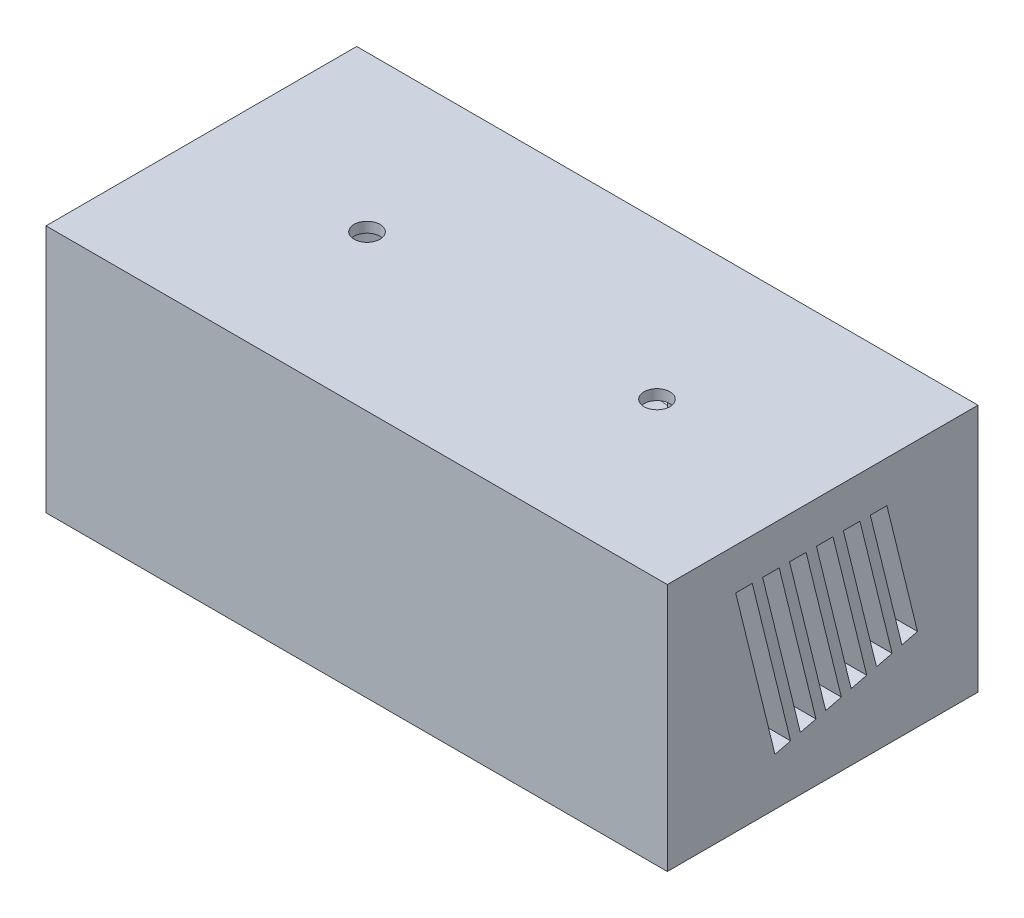
from build123d import *

# Parameters (mm, degrees)
SKETCH2_W                                     = 300
SKETCH2_H                                     = 150
BOSS_EXTRUDE1_DEPTH                           = 120
CUT_EXTRUDE2_DEPTH                            = 5
CUT_EXTRUDE3_DEPTH                            = 110
CBORE_FOR_M4_PAN_HEAD_MACHINE_SCREW1_AT_COUNT = 2
CBORE_FOR_M4_PAN_HEAD_MACHINE_SCREW1_AT_PITCH = 256
CBORE_FOR_M4_PAN_HEAD_MACHINE_SCREW1_2_COUNT  = 2
CBORE_FOR_M4_PAN_HEAD_MACHINE_SCREW1_2_PITCH  = 277.077606457
CBORE_FOR_M4_PAN_HEAD_MACHINE_SCREW1_3_COUNT  = 2
CBORE_FOR_M4_PAN_HEAD_MACHINE_SCREW1_3_PITCH  = 106
CUT_EXTRUDE5_DEPTH                            = 332.700165812
SKETCH17_R                                    = 15
CUT_EXTRUDE6_DEPTH                            = 20
SKETCH3_R                                     = 6.25
CUT_EXTRUDE1_DEPTH                            = 50


with BuildPart() as part:
    # Sketch2 → Boss-Extrude1 (new body)
    with BuildSketch(Plane(origin=(0, 0, 0), x_dir=(1, 0, 0), z_dir=(0, 1, 0))):
        Rectangle(SKETCH2_W, SKETCH2_H)
    extrude(amount=BOSS_EXTRUDE1_DEPTH)

    # Sketch7 → Cut-Extrude2 (cut)
    with BuildSketch(Plane.XZ):
        with BuildLine():
            Line((-120, 65), (120, 65))
            ThreePointArc((120, 65), (134.142135624, 59.142135624), (140, 45))
            Line((140, 45), (140, -45))
            ThreePointArc((140, -45), (134.142135624, -59.142135624), (120, -65))
            Line((120, -65), (-120, -65))
            ThreePointArc((-120, -65), (-134.142135624, -59.142135624), (-140, -45))
            Line((-140, -45), (-140, 45))
            ThreePointArc((-140, 45), (-134.142135624, 59.142135624), (-120, 65))
        make_face()
    extrude(amount=-CUT_EXTRUDE2_DEPTH, mode=Mode.SUBTRACT)

    # Sketch8 → Cut-Extrude3 (cut)
    with BuildSketch(Plane.XZ.offset(-5)):
        with BuildLine():
            Line((-91.715728753, 60), (91.715728753, 60))
            ThreePointArc((91.715728753, 60), (122.32233047, 47.32233047), (135, 16.715728753))
            Line((135, 16.715728753), (135, -16.715728753))
            ThreePointArc((135, -16.715728753), (122.32233047, -47.32233047), (91.715728753, -60))
            Line((91.715728753, -60), (-91.715728753, -60))
            ThreePointArc((-91.715728753, -60), (-122.32233047, -47.32233047), (-135, -16.715728753))
            Line((-135, -16.715728753), (-135, 16.715728753))
            ThreePointArc((-135, 16.715728753), (-122.32233047, 47.32233047), (-91.715728753, 60))
        make_face()
    extrude(amount=-CUT_EXTRUDE3_DEPTH, mode=Mode.SUBTRACT)

    # Sketch14 → CBORE for M4 Pan Head Machine Screw1 (revolve, cut)
    with BuildSketch(Plane(origin=(128, 0, -53), x_dir=(0, 0, -1), z_dir=(1, 0, 0))):
        Polygon((0, 0), (0, 31.351936393), (2.25, 30), (2.25, 3.1), (4.5, 3.1), (4.5, 0.025), (4.525, 0), align=None)
    cbore_for_m4_pan_head_machine_screw1 = revolve(axis=Axis((128, -6.35, -53), (0, 1, 0)), mode=Mode.SUBTRACT)

    # CBORE for M4 Pan Head Machine Screw1 at: CBORE for M4 Pan Head Machine Screw1 ×2
    with Locations(*[(-i * CBORE_FOR_M4_PAN_HEAD_MACHINE_SCREW1_AT_PITCH, 0, 0) for i in range(1, CBORE_FOR_M4_PAN_HEAD_MACHINE_SCREW1_AT_COUNT)]):
        add(cbore_for_m4_pan_head_machine_screw1, mode=Mode.SUBTRACT)

    # CBORE for M4 Pan Head Machine Screw1 2: CBORE for M4 Pan Head Machine Screw1 ×2
    with Locations(*[Vector(-0.9239288705910962, 0, 0.38256429797912606) * (i * CBORE_FOR_M4_PAN_HEAD_MACHINE_SCREW1_2_PITCH) for i in range(1, CBORE_FOR_M4_PAN_HEAD_MACHINE_SCREW1_2_COUNT)]):
        add(cbore_for_m4_pan_head_machine_screw1, mode=Mode.SUBTRACT)

    # CBORE for M4 Pan Head Machine Screw1 3: CBORE for M4 Pan Head Machine Screw1 ×2
    with Locations(*[(0, 0, i * CBORE_FOR_M4_PAN_HEAD_MACHINE_SCREW1_3_PITCH) for i in range(1, CBORE_FOR_M4_PAN_HEAD_MACHINE_SCREW1_3_COUNT)]):
        add(cbore_for_m4_pan_head_machine_screw1, mode=Mode.SUBTRACT)

    # Sketch15 → Cut-Extrude5 (cut, through all)
    with BuildSketch(Plane(origin=(150, 0, 0), x_dir=(0, 0, -1), z_dir=(1, 0, 0))):
        Polygon((-42, 100), (-23.029720743, 23.02020202), (-15.487735621, 24.878787879), (-34, 100), align=None)
        Polygon((-29, 100), (-10.773994919, 26.04040404), (-3.232009797, 27.898989899), (-21, 100), align=None)
        Polygon((-16, 100), (1.481730904, 29.060606061), (9.023716027, 30.919191919), (-8, 100), align=None)
        Polygon((-3, 100), (13.737456728, 32.080808081), (21.27944185, 33.939393939), (5, 100), align=None)
        Polygon((10, 100), (25.993182552, 35.101010101), (33.535167674, 36.95959596), (18, 100), align=None)
        Polygon((23, 100), (38.248908375, 38.121212121), (45.790893498, 39.97979798), (31, 100), align=None)
    extrude(amount=-CUT_EXTRUDE5_DEPTH, mode=Mode.SUBTRACT)

    # Sketch17 → Cut-Extrude6 (cut)
    with BuildSketch(Plane(origin=(0, 0, -75), x_dir=(-1, 0, 0), z_dir=(0, 0, -1))):
        with Locations((0, 60)):
            Circle(SKETCH17_R)
    extrude(amount=-CUT_EXTRUDE6_DEPTH, mode=Mode.SUBTRACT)

    # Sketch3 → Cut-Extrude1 (cut)
    with BuildSketch(Plane(origin=(0, 120, 0), x_dir=(1, 0, 0), z_dir=(0, 1, 0))):
        with Locations(Location((-70, 0, 0), (0, 0, 270))):
            Circle(SKETCH3_R)
        with Locations(Location((70, 0, 0), (0, 0, 270))):
            Circle(SKETCH3_R)
    extrude(amount=-CUT_EXTRUDE1_DEPTH, mode=Mode.SUBTRACT)


solid = part.part
